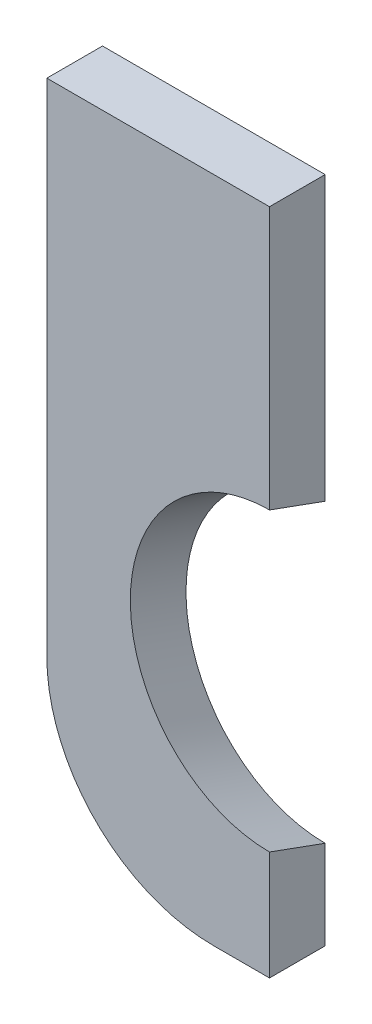
from build123d import *

# Parameters (mm, degrees)
BOSS_EXTRU_1_DEPTH      = 10
ENL_V_MAT_EXTRU_1_DEPTH = 127.885775404


with BuildPart() as part:
    # Esquisse1 → Boss.-Extru.1 (new body)
    with BuildSketch(Plane.XY):
        with BuildLine():
            Line((30, 0), (40, 0))
            Line((40, 0), (40, 120))
            Line((40, 120), (0, 120))
            Line((0, 120), (0, 30))
            ThreePointArc((0, 30), (8.786796564, 8.786796564), (30, 0))
        make_face()
    extrude(amount=BOSS_EXTRU_1_DEPTH)

    # Esquisse2 → Enlèv. mat.-Extru.1 (cut, through all)
    with BuildSketch(Plane(origin=(0, 0, 0), x_dir=(1, 0, 0), z_dir=(0, -0.34202014332566943, -0.9396926207859083))):
        with BuildLine():
            Line((40, -15), (40, -65))
            ThreePointArc((40, -65), (15, -40), (40, -15))
        make_face()
    extrude(amount=-ENL_V_MAT_EXTRU_1_DEPTH, mode=Mode.SUBTRACT)


solid = part.part
